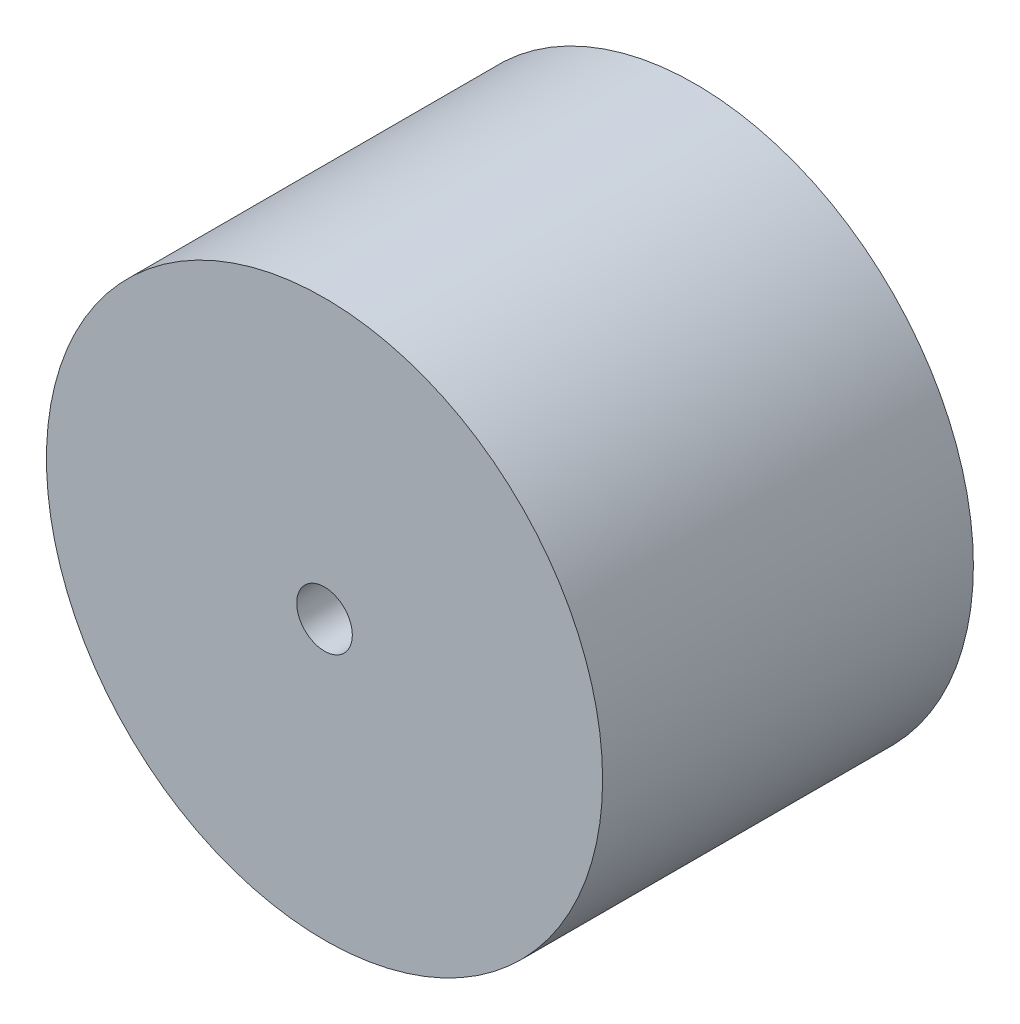
from build123d import *

# Parameters (mm, degrees)
CROQUIS1_R              = 15
SALIENTE_EXTRUIR1_DEPTH = 20
CROQUIS2_R              = 8
CORTAR_EXTRUIR1_DEPTH   = 13
CORTAR_EXTRUIR2_REACH   = 31.155
CROQUIS3_R              = 1.5


with BuildPart() as part:
    # Croquis1 → Saliente-Extruir1 (new body)
    with BuildSketch(Plane.XY):
        Circle(CROQUIS1_R)
    extrude(amount=SALIENTE_EXTRUIR1_DEPTH)

    # Croquis2 → Cortar-Extruir1 (cut)
    with BuildSketch(Plane(origin=(0, 0, 0), x_dir=(-1, 0, 0), z_dir=(0, 0, -1))):
        Circle(CROQUIS2_R)
    extrude(amount=-CORTAR_EXTRUIR1_DEPTH, mode=Mode.SUBTRACT)

    # Croquis3 → Cortar-Extruir2 (cut, up to next)
    with BuildSketch(Plane.XY.offset(20), mode=Mode.PRIVATE) as cortar_extruir2_sk1:
        Circle(CROQUIS3_R)
    cortar_extruir2_tool1 = extrude(cortar_extruir2_sk1.sketch, amount=-CORTAR_EXTRUIR2_REACH, mode=Mode.PRIVATE) & part.part
    add(cortar_extruir2_tool1.solids().sort_by_distance((0, 0, 20))[0], mode=Mode.SUBTRACT)


solid = part.part
